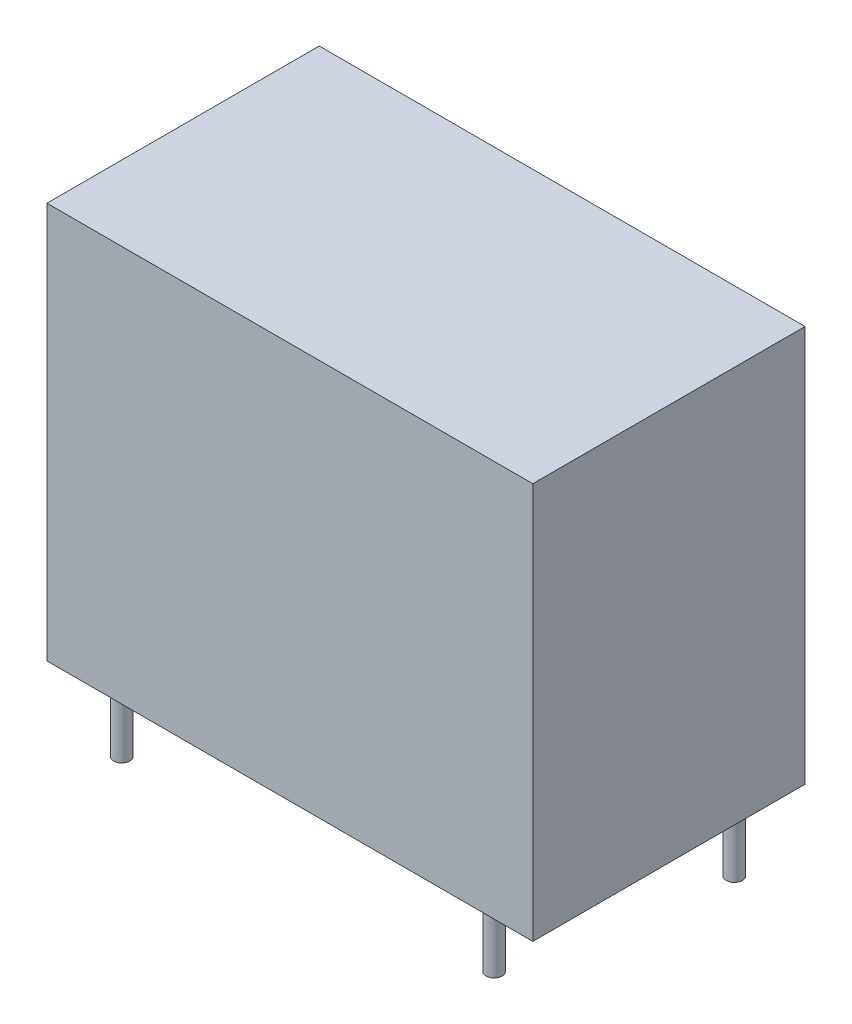
from build123d import *

# Parameters (mm, degrees)
SKETCH_1_W      = 18.2
SKETCH_1_H      = 10.2
EXTRUDE_1_DEPTH = 14.85
SKETCH_3_R      = 0.3
EXTRUDE_2_DEPTH = 3


with BuildPart() as part:
    # Эскиз1 → Бобышка-Вытянуть1 (new body)
    with BuildSketch(Plane(origin=(0, 0, 0), x_dir=(1, 0, 0), z_dir=(0, 1, 0))):
        Rectangle(SKETCH_1_W, SKETCH_1_H)
    extrude(amount=EXTRUDE_1_DEPTH)

    # Эскиз3 → Бобышка-Вытянуть2 (add)
    with BuildSketch(Plane.XZ):
        with Locations(Location((-7.6, 3.8, 0), (0, 0, 90))):
            Circle(SKETCH_3_R)
        with Locations(Location((-7.6, -3.8, 0), (0, 0, 90))):
            Circle(SKETCH_3_R)
        with Locations(Location((6.35, 3.8, 0), (0, 0, 90))):
            Circle(SKETCH_3_R)
        with Locations(Location((4.95, -3.8, 0), (0, 0, 90))):
            Circle(SKETCH_3_R)
        with Locations(Location((7.75, -3.8, 0), (0, 0, 90))):
            Circle(SKETCH_3_R)
    extrude(amount=EXTRUDE_2_DEPTH)


solid = part.part
